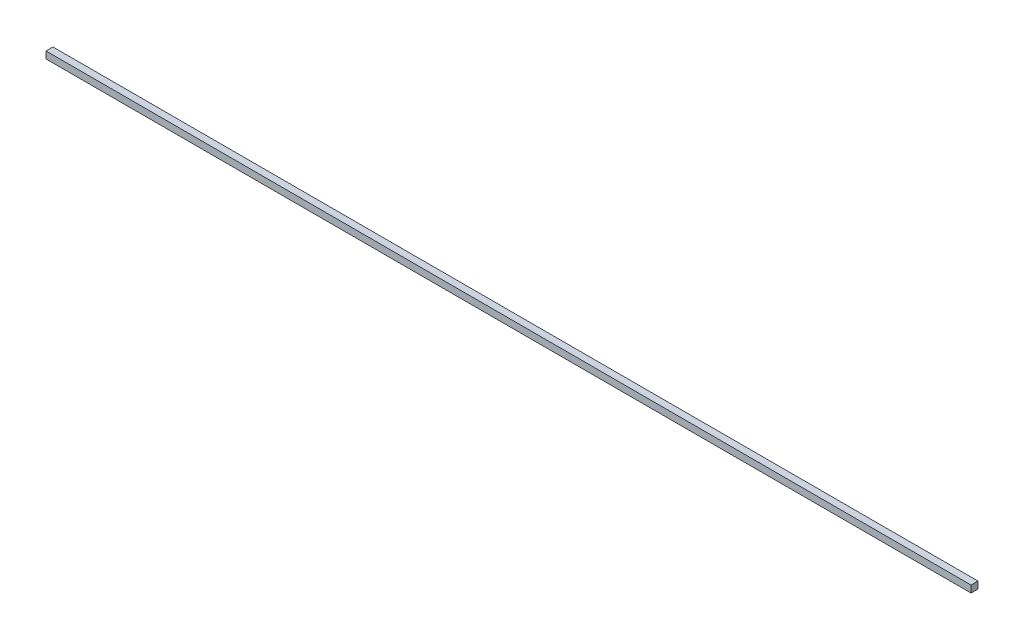
from build123d import *

# Parameters (mm, degrees)
MODEL_W         = 665.649258372
MODEL_H         = 5
EXTRUDE_1_DEPTH = 5


with BuildPart() as part:
    # Model → 凸台-拉伸1 (new body)
    with BuildSketch(Plane.XY):
        with Locations((989.078023935, 33.397612459)):
            Rectangle(MODEL_W, MODEL_H)
    extrude(amount=EXTRUDE_1_DEPTH)


solid = part.part
